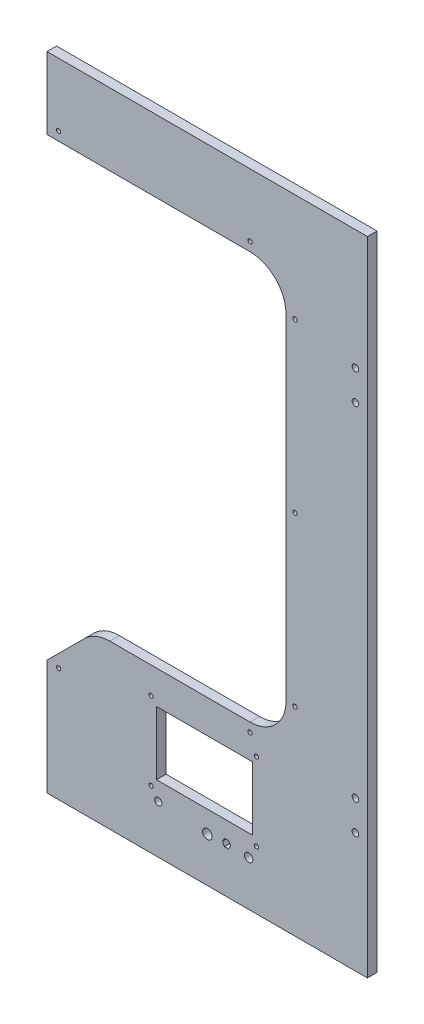
from build123d import *

# Parameters (mm, degrees)
SKETCH1_W           = 267.5
SKETCH1_H           = 536
SKETCH1_R           = 2.75
BOSS_EXTRUDE1_DEPTH = 8
SKETCH3_R           = 2.75
SKETCH3_R_2         = 1.75
SKETCH3_R_3         = 3.5
SKETCH3_R_4         = 4
SKETCH3_R_5         = 3
SKETCH3_W           = 80
SKETCH3_H           = 53
CUT_EXTRUDE3_DEPTH  = 379.740346412
SKETCH4_R           = 1.75
SKETCH4_R_2         = 1.786950001
CUT_EXTRUDE4_DEPTH  = 10


with BuildPart() as part:
    # Sketch1 → Boss-Extrude1 (new body)
    with BuildSketch(Plane.XY):
        with Locations((133.75, 0)):
            Rectangle(SKETCH1_W, SKETCH1_H)
        with Locations(Location((257.5, -168, 0), (0, 0, 180))):
            Circle(SKETCH1_R, mode=Mode.SUBTRACT)
        with Locations(Location((257.509341423, -143.000001745, 0), (0, 0, 180))):
            Circle(SKETCH1_R, mode=Mode.SUBTRACT)
        with Locations((257.509341423, 143.000001745)):
            Circle(SKETCH1_R, mode=Mode.SUBTRACT)
        with Locations((257.5, 168)):
            Circle(SKETCH1_R, mode=Mode.SUBTRACT)
    extrude(amount=-BOSS_EXTRUDE1_DEPTH)

    # Sketch3 → Cut-Extrude3 (cut, through all)
    with BuildSketch(Plane.XY):
        with Locations(Location((257.509341423, -143.000001745, 0), (0, 0, 180))):
            Circle(SKETCH3_R)
        with Locations(Location((257.5, -168, 0), (0, 0, 180))):
            Circle(SKETCH3_R)
        with Locations((86.878100048, -154.208377346)):
            Circle(SKETCH3_R_2)
        with Locations((174.878100048, -154.208377346)):
            Circle(SKETCH3_R_2)
        with Locations((174.878100048, -219.208377346)):
            Circle(SKETCH3_R_2)
        with Locations((86.878100048, -219.208377346)):
            Circle(SKETCH3_R_2)
        with Locations((168.378100048, -230.458377346)):
            Circle(SKETCH3_R_3)
        with Locations((133.878100048, -230.708377346)):
            Circle(SKETCH3_R_4)
        with Locations((92.878100048, -227.708377346)):
            Circle(SKETCH3_R_5)
        with BuildLine():
            Line((0, 208), (0, -172))
            Line((0, -172), (31.225700951, -140.783627636))
            ThreePointArc((31.225700951, -140.783627636), (40.957302403, -134.282756532), (52.435734985, -132))
            Line((52.435734985, -132), (169.5, -132))
            ThreePointArc((169.5, -132), (190.713203436, -123.213203436), (199.5, -102))
            Line((199.5, -102), (199.5, 178))
            ThreePointArc((199.5, 178), (190.713203436, 199.213203436), (169.5, 208))
            Line((169.5, 208), (0, 208))
        make_face()
        Polygon((153.342201663, -229.708377346), (151.610150855, -226.708377346), (148.14604924, -226.708377346), (146.413998433, -229.708377346), (148.14604924, -232.708377346), (151.610150855, -232.708377346), align=None)
        with Locations((131.378100048, -186.208377346)):
            Rectangle(SKETCH3_W, SKETCH3_H)
    extrude(amount=-CUT_EXTRUDE3_DEPTH, mode=Mode.SUBTRACT)

    # Sketch4 → Cut-Extrude4 (cut)
    with BuildSketch(Plane.XY):
        with Locations((9.726391767, -172.881531455)):
            Circle(SKETCH4_R)
        with Locations((169.5, -139.5)):
            Circle(SKETCH4_R_2)
        with Locations((207, -102)):
            Circle(SKETCH4_R)
        with Locations((207, 38)):
            Circle(SKETCH4_R)
        with Locations((207, 178)):
            Circle(SKETCH4_R)
        with Locations((169.5, 215.5)):
            Circle(SKETCH4_R)
        with Locations((9.726391767, 215.5)):
            Circle(SKETCH4_R)
    extrude(amount=-CUT_EXTRUDE4_DEPTH, mode=Mode.SUBTRACT)


solid = part.part
